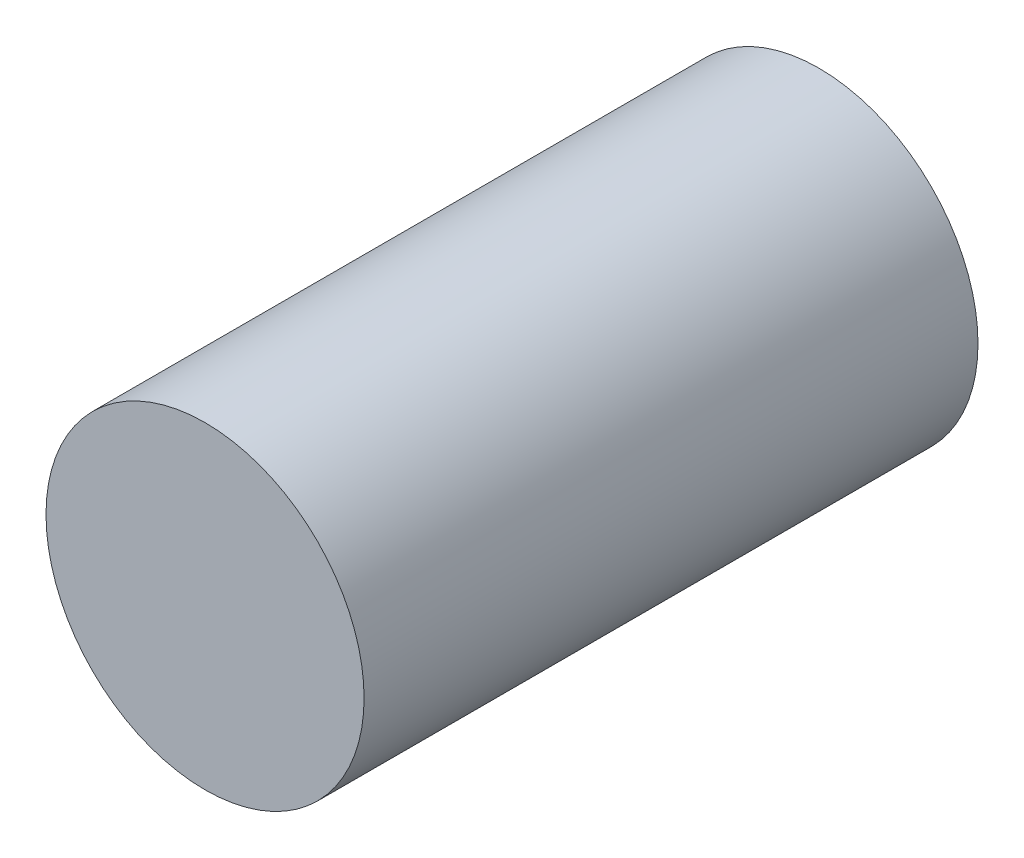
from build123d import *

# Parameters (mm, degrees)
SKETCH1_R           = 1
BOSS_EXTRUDE1_DEPTH = 1.93


with BuildPart() as part:
    # Sketch1 → Boss-Extrude1 (new, symmetric)
    with BuildSketch(Plane.XY):
        Circle(SKETCH1_R)
    extrude(amount=BOSS_EXTRUDE1_DEPTH, both=True)


solid = part.part
